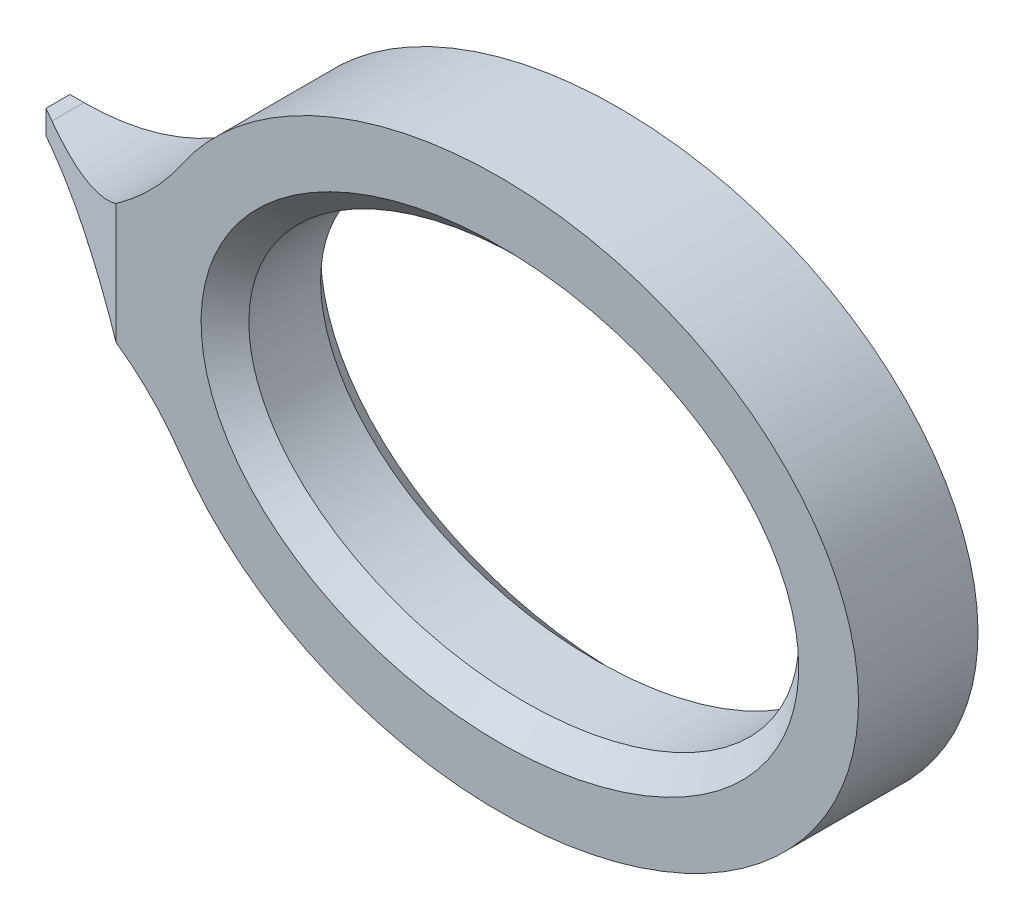
from build123d import *

# Parameters (mm, degrees)
SKETCH1_RX          = 11.5
SKETCH1_RY          = 8
BOSS_EXTRUDE1_DEPTH = 5
CHAMFER1_SIZE       = 1
CHAMFER2_SIZE       = 4
CHAMFER2_SIZE2      = 6.92820323


with BuildPart() as part:
    # Sketch1 → Boss-Extrude1 (new body)
    with BuildSketch(Plane.XY):
        with BuildLine():
            Line((-22.398310096, 0.5), (-22.9858156, 0.5))
            Line((-22.9858156, 0.5), (-22.9858156, -0.5))
            Line((-22.9858156, -0.5), (-22.398310096, -0.5))
            ThreePointArc((-22.398310096, -0.5), (-17.251966417, -1.77810992), (-13.301548721, -5.315427866))
            add(Edge.make_bspline(
                [(-13.301548721, -5.315427866), (-4.793562388, -17.829651935), (9.475696719, -8.914825968), (23.744955826, 0), (9.475696719, 8.914825968), (-4.793562388, 17.829651935), (-13.301548721, 5.315427866)],
                knots=[3.622079689, 3.622079689, 3.622079689, 5.396150101, 5.396150101, 7.170220513, 7.170220513, 8.944290925, 8.944290925, 8.944290925], degree=2, weights=[1, 0.631713115, 1, 0.631713115, 1, 0.631713115, 1]))
            ThreePointArc((-13.301548721, 5.315427866), (-17.251966417, 1.77810992), (-22.398310096, 0.5))
        make_face()
        with Locations((0, 0)):
            Ellipse(SKETCH1_RX, SKETCH1_RY, mode=Mode.SUBTRACT)
    extrude(amount=BOSS_EXTRUDE1_DEPTH)

    # Chamfer1
    chamfer1_edges = [part.edges().sort_by_distance(p)[0] for p in [
        (-11.499996843, -0.00592777, 0),
        (-11.499996843, -0.00592777, 5),
    ]]
    chamfer(chamfer1_edges, length=CHAMFER1_SIZE)

    # Chamfer2
    chamfer2_edges = [part.edges().sort_by_distance(p)[0] for p in [
        (-22.9858156, 0, 5),
    ]]
    chamfer2_side = [part.faces().sort_by_distance(p)[0] for p in [
        (-22.9858156, 0, 2.5),
    ]]
    chamfer(chamfer2_edges, length=CHAMFER2_SIZE, length2=CHAMFER2_SIZE2, reference=chamfer2_side[0])


solid = part.part
